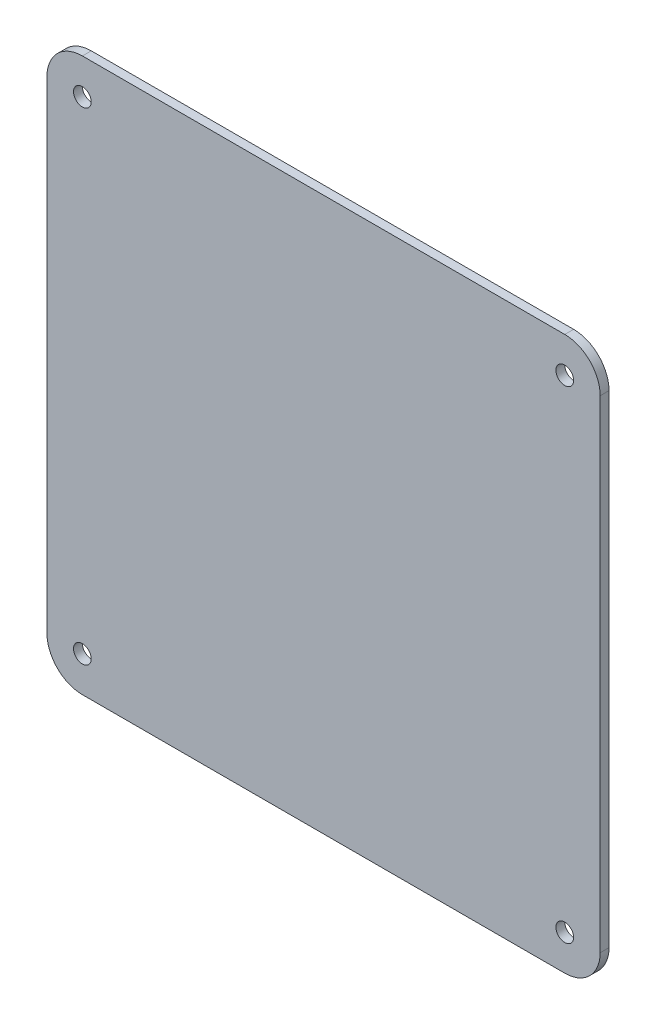
from build123d import *

# Parameters (mm, degrees)
SKETCH1_R           = 4
BOSS_EXTRUDE1_DEPTH = 4


with BuildPart() as part:
    # Sketch1 → Boss-Extrude1 (new body)
    with BuildSketch(Plane.XY):
        with BuildLine():
            Line((-109, 125), (109, 125))
            ThreePointArc((109, 125), (120.313708499, 120.313708499), (125, 109))
            Line((125, 109), (125, -109))
            ThreePointArc((125, -109), (120.313708499, -120.313708499), (109, -125))
            Line((109, -125), (-109, -125))
            ThreePointArc((-109, -125), (-120.313708499, -120.313708499), (-125, -109))
            Line((-125, -109), (-125, 109))
            ThreePointArc((-125, 109), (-120.313708499, 120.313708499), (-109, 125))
        make_face()
        with Locations((-109, -109)):
            Circle(SKETCH1_R, mode=Mode.SUBTRACT)
        with Locations((-109, 109)):
            Circle(SKETCH1_R, mode=Mode.SUBTRACT)
        with Locations((109, 109)):
            Circle(SKETCH1_R, mode=Mode.SUBTRACT)
        with Locations((109, -109)):
            Circle(SKETCH1_R, mode=Mode.SUBTRACT)
    extrude(amount=BOSS_EXTRUDE1_DEPTH)


solid = part.part
